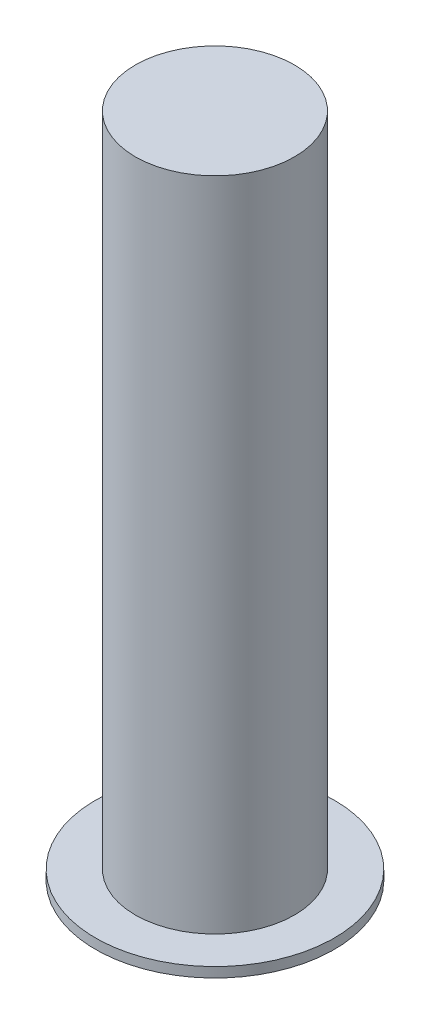
from build123d import *

# Parameters (mm, degrees)
SKETCH1_R           = 4
BOSS_EXTRUDE1_DEPTH = 33
SKETCH2_R           = 6
BOSS_EXTRUDE2_DEPTH = 0.5


with BuildPart() as part:
    # Sketch1 → Boss-Extrude1 (new body)
    with BuildSketch(Plane(origin=(0, 0, 0), x_dir=(1, 0, 0), z_dir=(0, 1, 0))):
        with Locations(Location((0, 0, 0), (0, 0, 270))):
            Circle(SKETCH1_R)
    extrude(amount=BOSS_EXTRUDE1_DEPTH)

    # Sketch2 → Boss-Extrude2 (add)
    with BuildSketch(Plane.XZ):
        with Locations(Location((0, 0, 0), (0, 0, 270))):
            Circle(SKETCH2_R)
    extrude(amount=BOSS_EXTRUDE2_DEPTH)


solid = part.part
